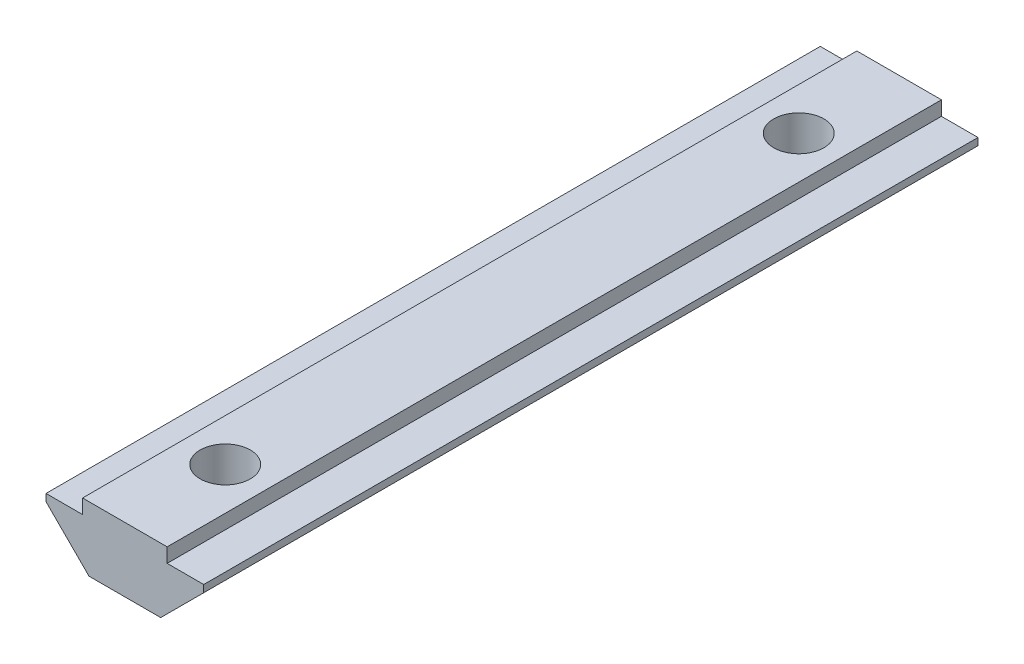
from build123d import *

# Parameters (mm, degrees)
BOSS_EXTRU_1_DEPTH      = 54
ESQUISSE2_R             = 1.75
ENL_V_MAT_EXTRU_1_DEPTH = 55.465585465


with BuildPart() as part:
    # Esquisse1 → Boss.-Extru.1 (new body)
    with BuildSketch(Plane.XY):
        Polygon((-2.5, 0), (2.5, 0), (5.5, 3), (5.5, 3.5), (2.95, 3.5), (2.95, 4.5), (-2.95, 4.5), (-2.95, 3.5), (-5.5, 3.5), (-5.5, 3), align=None)
    extrude(amount=BOSS_EXTRU_1_DEPTH)

    # Esquisse2 → Enlèv. mat.-Extru.1 (cut, through all)
    with BuildSketch(Plane(origin=(0, 4.5, 0), x_dir=(1, 0, 0), z_dir=(0, 1, 0))):
        with Locations(Location((0, -7, 0), (0, 0, 270))):
            Circle(ESQUISSE2_R)
        with Locations(Location((0, -47, 0), (0, 0, 90))):
            Circle(ESQUISSE2_R)
    extrude(amount=-ENL_V_MAT_EXTRU_1_DEPTH, mode=Mode.SUBTRACT)


solid = part.part
